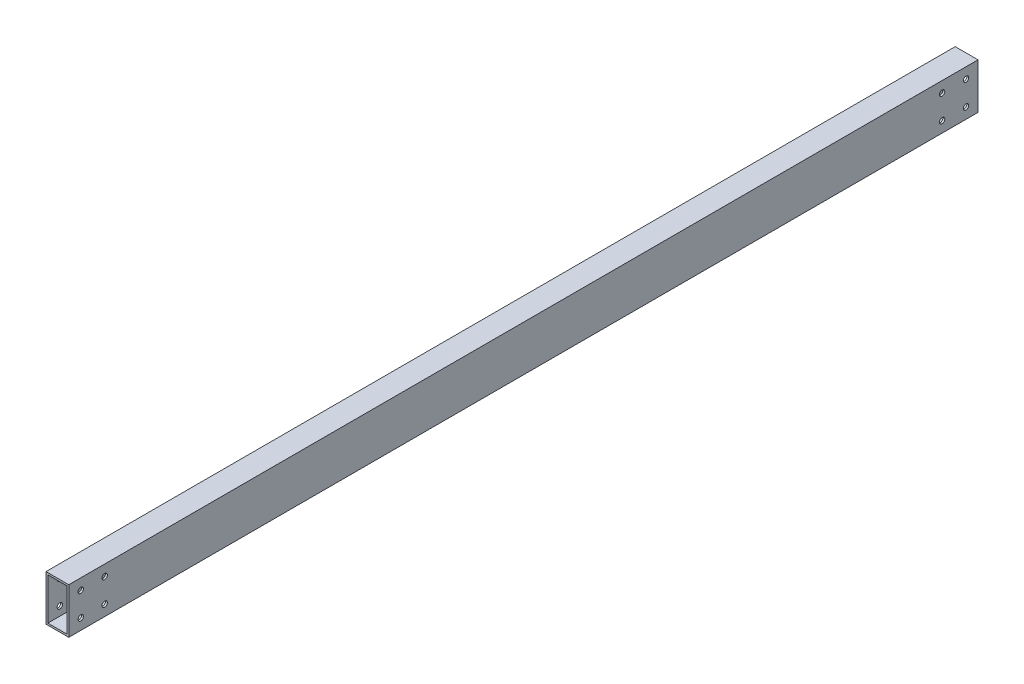
from build123d import *

# Parameters (mm, degrees)
SKETCH1_W                = 38.1
SKETCH1_H                = 76.2
SKETCH1_W_2              = 31.75
SKETCH1_H_2              = 69.85
EXTRUDE_THIN1_DEPTH      = 760
M8_CLEARANCE_HOLE2_D     = 9
M8_CLEARANCE_HOLE2_DEPTH = 3.175
M8_CLEARANCE_HOLE1_D     = 9


with BuildPart() as part:
    # Sketch1 → Extrude-Thin1 (new, symmetric)
    with BuildSketch(Plane.XY):
        Rectangle(SKETCH1_W, SKETCH1_H)
        Rectangle(SKETCH1_W_2, SKETCH1_H_2, mode=Mode.SUBTRACT)
    extrude(amount=EXTRUDE_THIN1_DEPTH, both=True)

    # M8 Clearance Hole2
    with Locations(Plane(origin=(19.05, 0, 0), x_dir=(0, 0, -1), z_dir=(1, 0, 0))):
        with Locations((-740, 20), (-740, -20), (-700, 20), (-700, -20)):
            m8_clearance_hole2 = Hole(M8_CLEARANCE_HOLE2_D / 2, depth=M8_CLEARANCE_HOLE2_DEPTH)

    # M8 Clearance Hole1 (through all)
    with Locations(Plane(origin=(-15.875, 0, 0), x_dir=(0, 0, -1), z_dir=(1, 0, 0))):
        with Locations((-740, 20), (-740, -20), (-700, 20), (-700, -20)):
            m8_clearance_hole1 = Hole(M8_CLEARANCE_HOLE1_D / 2)

    # Mirror1: M8 Clearance Hole2, M8 Clearance Hole1 across plane
    add(m8_clearance_hole2.mirror(Plane.XY), mode=Mode.SUBTRACT)
    add(m8_clearance_hole1.mirror(Plane.XY), mode=Mode.SUBTRACT)


solid = part.part
